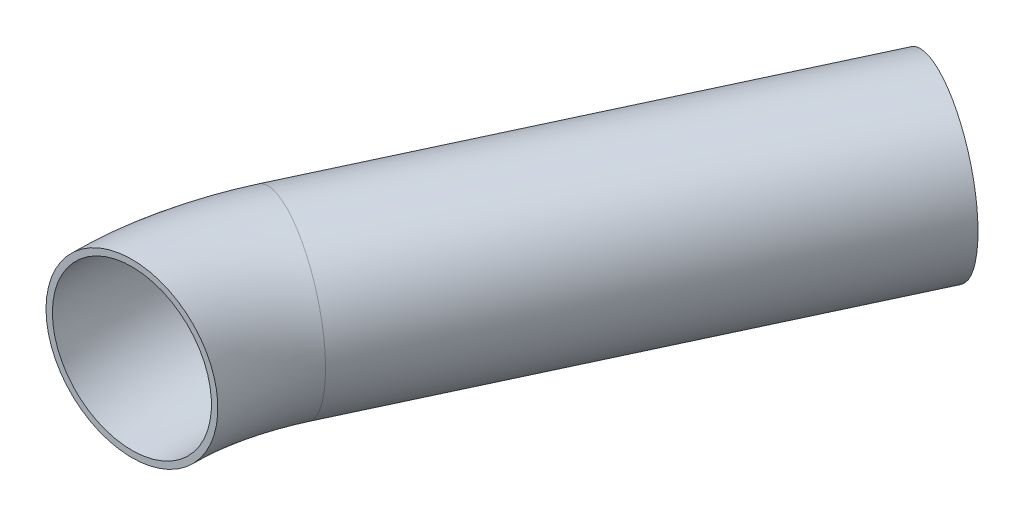
from build123d import *

# Parameters (mm, degrees)
SKETCH2_R   = 22.225
SKETCH2_R_2 = 20.574


with BuildPart() as part:
    # Sweep1: sweep along a path in Sketch1
    with BuildLine(Plane(origin=(0, 0, 0), x_dir=(1, 0, 0), z_dir=(0, 1, 0))) as sweep1_path:
        Line((60.811865869, 147.304600498), (7.139346628, 32.203511545))
        ThreePointArc((7.139346628, 32.203511545), (1.806244257, 16.492698582), (0, 0))
    # Sketch2 → Sweep1 (sweep)
    with BuildSketch(Plane.XY):
        Circle(SKETCH2_R)
        Circle(SKETCH2_R_2, mode=Mode.SUBTRACT)
    sweep(path=sweep1_path.line)


solid = part.part
